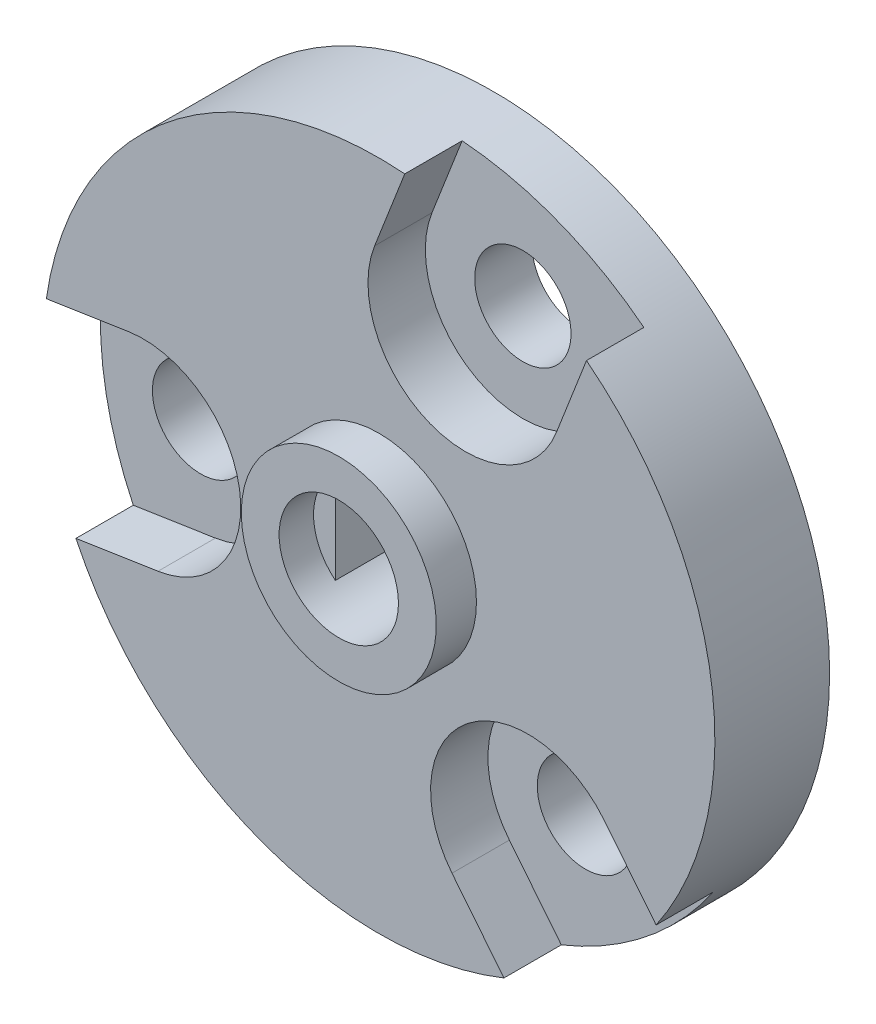
from build123d import *

# Parameters (mm, degrees)
SKETCH1_R           = 14.642304845
BOSS_EXTRUDE1_DEPTH = 2.5
BOSS_EXTRUDE2_DEPTH = 2.5
SKETCH3_R           = 4.25
BOSS_EXTRUDE3_DEPTH = 1.75
SKETCH4_R           = 2.1
CUT_EXTRUDE1_DEPTH  = 22.138984895
SKETCH5_R           = 2.6
CUT_EXTRUDE2_DEPTH  = 1.5
CUT_EXTRUDE3_REACH  = 23.78


with BuildPart() as part:
    # Sketch1 → Boss-Extrude1 (new body)
    with BuildSketch(Plane.XY):
        Circle(SKETCH1_R)
    extrude(amount=BOSS_EXTRUDE1_DEPTH)

    # Sketch2 → Boss-Extrude2 (add)
    with BuildSketch(Plane.XY.offset(2.5)):
        with BuildLine():
            Line((9.046191288, 11.513622991), (7.732334838, 8.140853638))
            ThreePointArc((7.732334838, 8.140853638), (2.22953316, 5.723381055), (-0.187939423, 11.226182734))
            Line((-0.187939423, 11.226182734), (1.125917027, 14.598952087))
            ThreePointArc((1.125917027, 14.598952087), (-9.158320976, 11.424633389), (-14.494185643, 2.077419967))
            Line((-14.494185643, 2.077419967), (-10.916353478, 2.625971582))
            ThreePointArc((-10.916353478, 2.625971582), (-6.071359969, -0.930858173), (-9.628189724, -5.775851681))
            Line((-9.628189724, -5.775851681), (-13.206021889, -6.324403296))
            ThreePointArc((-13.206021889, -6.324403296), (-5.314862256, -13.643655316), (5.447994356, -13.591042958))
            Line((5.447994356, -13.591042958), (3.18401864, -10.766825219))
            ThreePointArc((3.18401864, -10.766825219), (3.84182681, -4.792522882), (9.816129146, -5.450331052))
            Line((9.816129146, -5.450331052), (12.080104862, -8.274548791))
            ThreePointArc((12.080104862, -8.274548791), (14.473183232, 2.219021927), (9.046191288, 11.513622991))
        make_face()
    extrude(amount=BOSS_EXTRUDE2_DEPTH)

    # Sketch3 → Boss-Extrude3 (add)
    with BuildSketch(Plane.XY.offset(5)):
        with Locations(Location((0, 0, 0), (0, 0, 180))):
            Circle(SKETCH3_R)
    extrude(amount=BOSS_EXTRUDE3_DEPTH)

    # Sketch4 → Cut-Extrude1 (cut, through all)
    with BuildSketch(Plane.XY.offset(2.5)):
        with Locations((3.772197708, 9.683518186)):
            Circle(SKETCH4_R)
        with Locations((-10.272271601, -1.57494005)):
            Circle(SKETCH4_R)
        with Locations((6.500073893, -8.108578136)):
            Circle(SKETCH4_R)
    extrude(amount=-CUT_EXTRUDE1_DEPTH, mode=Mode.SUBTRACT)

    # Sketch5 → Cut-Extrude2 (cut)
    with BuildSketch(Plane.XY.offset(6.75)):
        Circle(SKETCH5_R)
    extrude(amount=-CUT_EXTRUDE2_DEPTH, mode=Mode.SUBTRACT)

    # Sketch6 → Cut-Extrude3 (cut, up to next)
    with BuildSketch(Plane.XY.offset(6.75), mode=Mode.PRIVATE) as cut_extrude3_sk1:
        with BuildLine():
            Line((-1.65, 2.00935313), (-1.65, -2.00935313))
            ThreePointArc((-1.65, -2.00935313), (0, -2.6), (1.65, -2.00935313))
            Line((1.65, -2.00935313), (1.65, 2.00935313))
            ThreePointArc((1.65, 2.00935313), (0, 2.6), (-1.65, 2.00935313))
        make_face()
    cut_extrude3_tool1 = extrude(cut_extrude3_sk1.sketch, amount=-CUT_EXTRUDE3_REACH, mode=Mode.PRIVATE) & part.part
    add(cut_extrude3_tool1.solids().sort_by_distance((0, 0, 6.75))[0], mode=Mode.SUBTRACT)


solid = part.part
